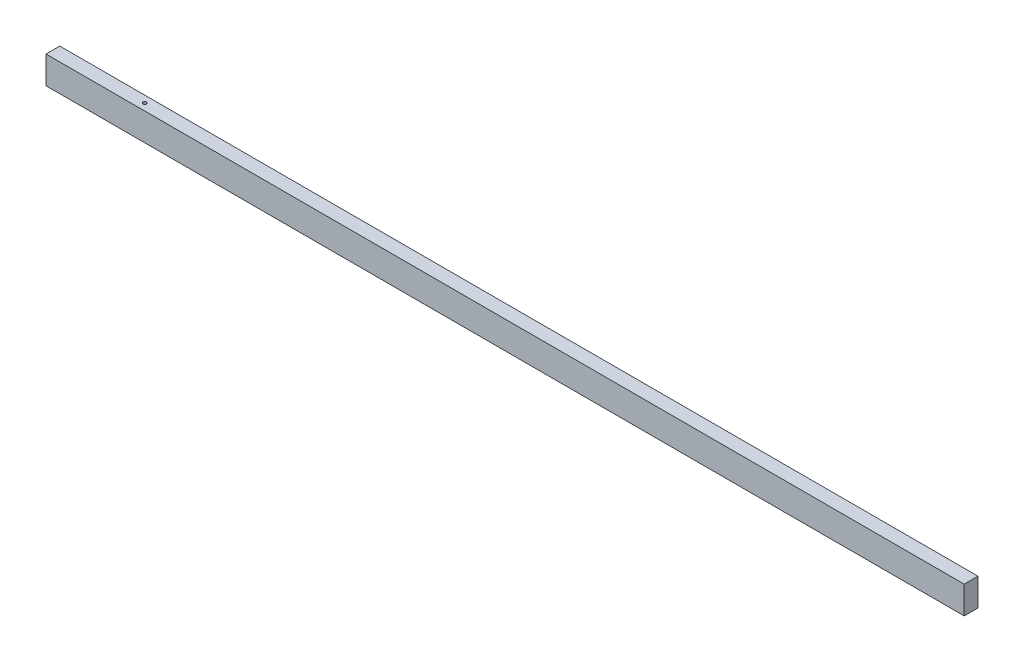
from build123d import *

# Parameters (mm, degrees)
SKETCH1_W                      = 100
SKETCH1_H                      = 3
BOSS_EXTRUDE1_DEPTH            = 1.5
SCALE1_SCALE                   = 10
F_6_0_204_DIAMETER_HOLE1_D     = 3.81
F_6_0_204_DIAMETER_HOLE1_DEPTH = 49


with BuildPart() as part:
    # Sketch1 → Boss-Extrude1 (new body)
    with BuildSketch(Plane.XY):
        with Locations((50, 1.5)):
            Rectangle(SKETCH1_W, SKETCH1_H)
    extrude(amount=BOSS_EXTRUDE1_DEPTH)


with BuildPart() as part_1:
    # Scale1: scaled about (0, 0, 0)
    add(part.part.scale(SCALE1_SCALE))

    # #6 (0.204) Diameter Hole1
    with Locations(Plane(origin=(-109.418477494, 30, -1000), x_dir=(1, 0, 0), z_dir=(0, 1, 0))):
        with Locations((209.418477494, -1007.5)):
            Hole(F_6_0_204_DIAMETER_HOLE1_D / 2, depth=F_6_0_204_DIAMETER_HOLE1_DEPTH)


solid = part_1.part
